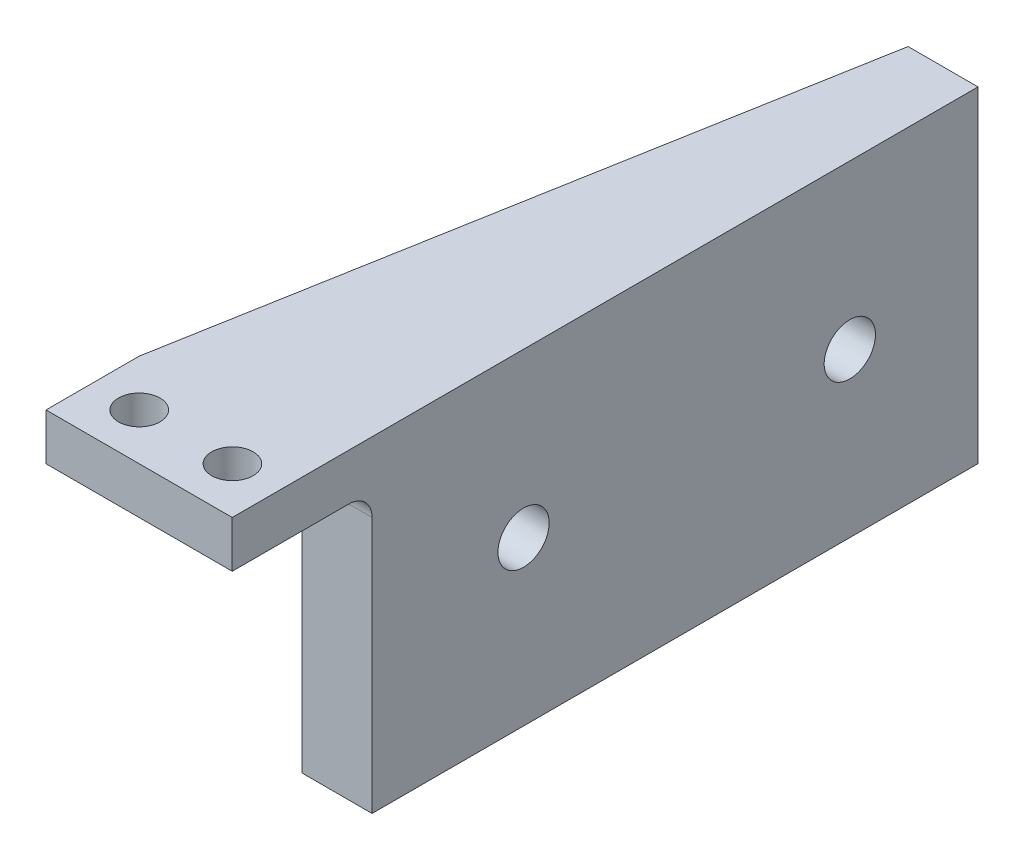
from build123d import *

# Parameters (mm, degrees)
SKETCH1_R           = 1.1303
BOSS_EXTRUDE1_DEPTH = 2.54
SKETCH2_W           = 3.81
SKETCH2_H           = 33.02
BOSS_EXTRUDE2_DEPTH = 15.24
FILLET1_R           = 1.27
SKETCH3_R           = 1.397
CUT_EXTRUDE1_DEPTH  = 12.7


with BuildPart() as part:
    # Sketch1 → Boss-Extrude1 (new body)
    with BuildSketch(Plane(origin=(0, 0, 0), x_dir=(1, 0, 0), z_dir=(0, 1, 0))):
        Polygon((-2.54, 2.54), (3.79857, 38.1), (7.60857, 38.1), (7.60857, 2.54), (7.60857, -2.54), (-2.54, -2.54), align=None)
        with Locations(Location((0, 0, 0), (0, 0, 270))):
            Circle(SKETCH1_R, mode=Mode.SUBTRACT)
        with Locations(Location((5.08, 0, 0), (0, 0, 270))):
            Circle(SKETCH1_R, mode=Mode.SUBTRACT)
    extrude(amount=BOSS_EXTRUDE1_DEPTH)

    # Sketch2 → Boss-Extrude2 (add)
    with BuildSketch(Plane.XZ):
        with Locations((5.70357, -21.59)):
            Rectangle(SKETCH2_W, SKETCH2_H)
    extrude(amount=BOSS_EXTRUDE2_DEPTH)

    # Fillet1
    fillet1_edges = [part.edges().sort_by_distance(p)[0] for p in [
        (5.70357, 0, -5.08),
        (3.79857, 0, -21.59),
    ]]
    fillet(fillet1_edges, radius=FILLET1_R)

    # Sketch3 → Cut-Extrude1 (cut)
    with BuildSketch(Plane(origin=(7.60857, 0, 0), x_dir=(0, 0, -1), z_dir=(1, 0, 0))):
        with Locations((13.335254, -6.35)):
            Circle(SKETCH3_R)
        with Locations((31.115254, -6.35)):
            Circle(SKETCH3_R)
    extrude(amount=-CUT_EXTRUDE1_DEPTH, mode=Mode.SUBTRACT)


solid = part.part
